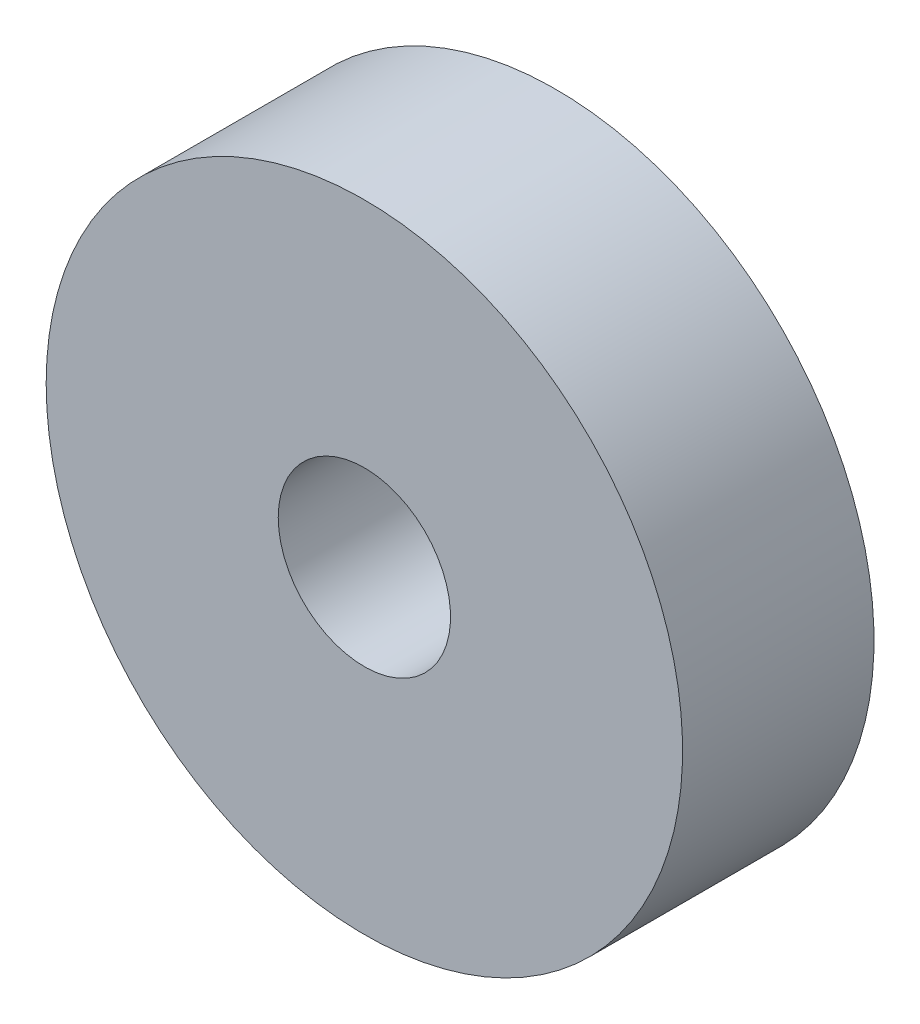
from build123d import *

# Parameters (mm, degrees)
SKETCH_1_W = 3.636924234
SKETCH_1_H = 3


with BuildPart() as part:
    # 草图1 → 旋转1 (revolve)
    with BuildSketch(Plane.XZ.offset(0.000237799), mode=Mode.PRIVATE) as revolve_1_sk:
        with Locations((3.168462096, 1.895813093)):
            Rectangle(SKETCH_1_W, SKETCH_1_H)
    revolve(revolve_1_sk.sketch.rotate(Axis((-0.000237799, -0.000237799, 3.395813093), (0, 0, -1)), 180), axis=Axis((-0.000237799, -0.000237799, 3.395813093), (0, 0, -1)))


solid = part.part
